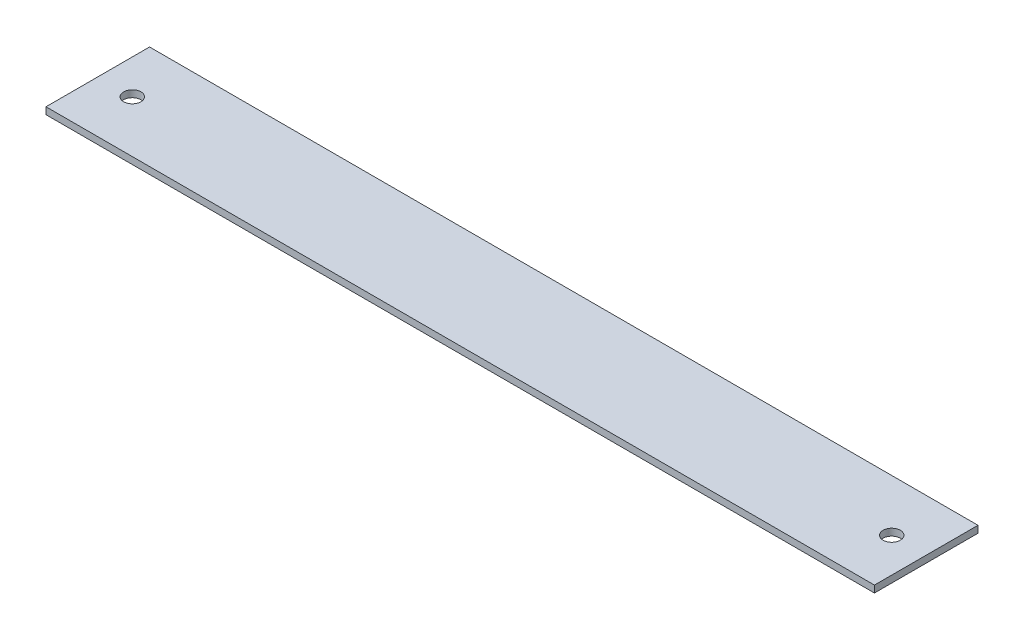
from build123d import *

# Parameters (mm, degrees)
SKETCH_1_W      = 120
SKETCH_1_H      = 15
EXTRUDE_1_DEPTH = 1
M3X0_5_1_D      = 2.5


with BuildPart() as part:
    # ｽｹｯﾁ1 → ﾎﾞｽ - 押し出し1 (new body)
    with BuildSketch(Plane(origin=(0, 0, 0), x_dir=(1, 0, 0), z_dir=(0, 1, 0))):
        with Locations((60, 7.5)):
            Rectangle(SKETCH_1_W, SKETCH_1_H)
    extrude(amount=EXTRUDE_1_DEPTH)

    # M3x0.5 ねじ穴1 (through all)
    with Locations(Plane(origin=(0, 1, 0), x_dir=(1, 0, 0), z_dir=(0, 1, 0))):
        with Locations((5, 7.5), (115, 7.5)):
            Hole(M3X0_5_1_D / 2)


solid = part.part
